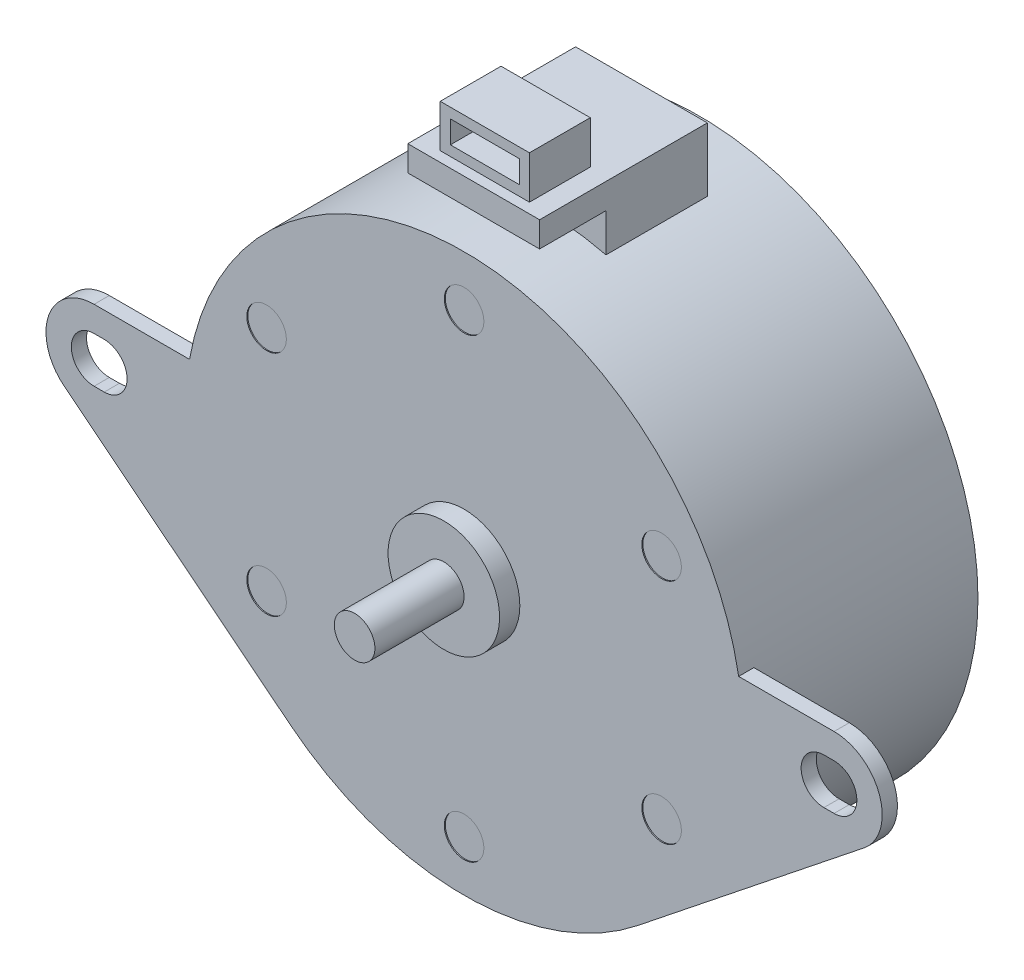
from build123d import *

# Parameters (mm, degrees)
SKETCH1_W                    = 27.5
SKETCH1_H                    = 23.2
BOSS_EXTRUDE1_REACH          = 86.991
BOSS_EXTRUDE1_END_RADIUS     = 27.5
SKETCH2_W                    = 13
SKETCH2_H                    = 10
SKETCH3_W                    = 13
SKETCH3_H                    = 2.5
BOSS_EXTRUDE2_DEPTH          = 6.553262411
BOSS_EXTRUDE3_DEPTH          = 1.5
BOSS_EXTRUDE4_DEPTH          = 1.5
CUT_EXTRUDE1_DEPTH           = 95.472495998
CUT_EXTRUDE2_DEPTH           = 95.115368033
SKETCH8_R                    = 5.5
BOSS_EXTRUDE5_DEPTH          = 2
SKETCH9_R                    = 2
BOSS_EXTRUDE6_DEPTH          = 8.8
SKETCH10_W                   = 8.8
SKETCH10_H                   = 6
BOSS_EXTRUDE7_DEPTH          = 4.22
SKETCH11_W                   = 6.8
SKETCH11_H                   = 2.22
CUT_EXTRUDE3_DEPTH           = 5
SKETCH12_R                   = 19.15
BOSS_EXTRUDE8_DEPTH          = 1.5
BOSS_EXTRUDE8_TAPER          = 45
F_7_0_7_DIAMETER_HOLE1_D     = 7
F_7_0_7_DIAMETER_HOLE1_DEPTH = 1.5
SKETCH15_W                   = 1.95
SKETCH15_H                   = 0.1
SKETCH16_W                   = 1.95
SKETCH16_H                   = 0.1
SKETCH17_W                   = 1.95
SKETCH17_H                   = 0.1
SKETCH18_W                   = 1.95
SKETCH18_H                   = 0.1
SKETCH19_W                   = 1.95
SKETCH19_H                   = 0.1
SKETCH20_W                   = 1.95
SKETCH20_H                   = 0.1
SKETCH21_W                   = 2
SKETCH21_H                   = 7
SKETCH22_W                   = 1.95
SKETCH22_H                   = 0.9
SKETCH23_W                   = 1.95
SKETCH23_H                   = 0.9
SKETCH24_W                   = 1.95
SKETCH24_H                   = 0.9
SKETCH25_W                   = 1.95
SKETCH25_H                   = 0.9
SKETCH26_W                   = 1.95
SKETCH26_H                   = 0.9
SKETCH27_W                   = 1.95
SKETCH27_H                   = 0.9


with BuildPart() as part:
    # Sketch1 → Revolve1 (revolve)
    with BuildSketch(Plane.XZ.offset(-27.5), mode=Mode.PRIVATE) as revolve1_sk:
        with Locations((41.25, 11.6)):
            Rectangle(SKETCH1_W, SKETCH1_H)
    revolve(revolve1_sk.sketch.rotate(Axis((27.5, 27.5, 23.2), (0, 0, -1)), 180), axis=Axis((27.5, 27.5, 23.2), (0, 0, -1)))

    # Boss-Extrude1: up to this cylinder (the profile starts outside it)
    boss_extrude1_end = Plane(origin=(27.5, 27.5, 10.7), z_dir=(0, 0, -1)) * Cylinder(BOSS_EXTRUDE1_END_RADIUS, 229.982, mode=Mode.PRIVATE)
    # Sketch2 → Boss-Extrude1 (add, up to the surface)
    with BuildSketch(Plane(origin=(0, 60.5, 0), x_dir=(1, 0, 0), z_dir=(0, 1, 0)), mode=Mode.PRIVATE) as boss_extrude1_sk1:
        with Locations((27.5, -10.7)):
            Rectangle(SKETCH2_W, SKETCH2_H)
    boss_extrude1_tool1 = extrude(boss_extrude1_sk1.sketch, amount=-BOSS_EXTRUDE1_REACH, mode=Mode.PRIVATE) - boss_extrude1_end
    add(boss_extrude1_tool1.solids().sort_by_distance((27.5, 60.5, 10.7))[0])

    # Sketch3 → Boss-Extrude2 (add)
    with BuildSketch(Plane.XY.offset(15.7)):
        with Locations((27.5, 59.25)):
            Rectangle(SKETCH3_W, SKETCH3_H)
    extrude(amount=BOSS_EXTRUDE2_DEPTH)

    # Sketch4 → Boss-Extrude3 (add)
    with BuildSketch(Plane.XY.offset(23.2)):
        with BuildLine():
            Line((64, 32.25), (54.586666462, 32.25))
            ThreePointArc((54.586666462, 32.25), (53.216477037, 17.757679496), (44.640410959, 5.995202578))
            Line((44.640410959, 5.995202578), (66.960616438, 23.785534991))
            ThreePointArc((66.960616438, 23.785534991), (68.483648559, 29.068246028), (64, 32.25))
        make_face()
    extrude(amount=-BOSS_EXTRUDE3_DEPTH)

    # Sketch5 → Boss-Extrude4 (add)
    with BuildSketch(Plane.XY.offset(23.2)):
        with BuildLine():
            Line((-11.960616438, 23.785534991), (10.359589041, 5.995202578))
            ThreePointArc((10.359589041, 5.995202578), (1.783522963, 17.757679496), (0.413333538, 32.25))
            Line((0.413333538, 32.25), (-9, 32.25))
            ThreePointArc((-9, 32.25), (-13.483648559, 29.068246028), (-11.960616438, 23.785534991))
        make_face()
    extrude(amount=-BOSS_EXTRUDE4_DEPTH)

    # Sketch6 → Cut-Extrude1 (cut, through all)
    with BuildSketch(Plane.XY.offset(23.2)):
        with BuildLine():
            Line((63, 25.25), (64, 25.25))
            ThreePointArc((64, 25.25), (66.25, 27.5), (64, 29.75))
            Line((64, 29.75), (63, 29.75))
            ThreePointArc((63, 29.75), (60.75, 27.5), (63, 25.25))
        make_face()
    extrude(amount=-CUT_EXTRUDE1_DEPTH, mode=Mode.SUBTRACT)

    # Sketch7 → Cut-Extrude2 (cut, through all)
    with BuildSketch(Plane(origin=(0, 0, 21.7), x_dir=(-1, 0, 0), z_dir=(0, 0, -1))):
        with BuildLine():
            Line((8, 25.25), (9, 25.25))
            ThreePointArc((9, 25.25), (11.25, 27.5), (9, 29.75))
            Line((9, 29.75), (8, 29.75))
            ThreePointArc((8, 29.75), (5.75, 27.5), (8, 25.25))
        make_face()
    extrude(amount=-CUT_EXTRUDE2_DEPTH, mode=Mode.SUBTRACT)

    # Sketch8 → Boss-Extrude5 (add)
    with BuildSketch(Plane.XY.offset(23.2)):
        with Locations((27.5, 27.5)):
            Circle(SKETCH8_R)
    extrude(amount=BOSS_EXTRUDE5_DEPTH)

    # Sketch9 → Boss-Extrude6 (add)
    with BuildSketch(Plane.XY.offset(25.2)):
        with Locations((27.5, 27.5)):
            Circle(SKETCH9_R)
    extrude(amount=BOSS_EXTRUDE6_DEPTH)

    # Sketch10 → Boss-Extrude7 (add)
    with BuildSketch(Plane(origin=(0, 60.5, 0), x_dir=(-1, 0, 0), z_dir=(0, 1, 0))):
        with Locations((-27.6, 18.253262411)):
            Rectangle(SKETCH10_W, SKETCH10_H)
    extrude(amount=BOSS_EXTRUDE7_DEPTH)

    # Sketch11 → Cut-Extrude3 (cut)
    with BuildSketch(Plane.XY.offset(21.253262411)):
        with Locations((27.6, 62.61)):
            Rectangle(SKETCH11_W, SKETCH11_H)
    extrude(amount=-CUT_EXTRUDE3_DEPTH, mode=Mode.SUBTRACT)

    # Sketch12 → Boss-Extrude8 (add)
    with BuildSketch(Plane(origin=(0, 0, 0), x_dir=(-1, 0, 0), z_dir=(0, 0, -1))):
        with Locations((-27.5, 27.5)):
            Circle(SKETCH12_R)
    extrude(amount=BOSS_EXTRUDE8_DEPTH, taper=BOSS_EXTRUDE8_TAPER)

    # Ø7.0 (7) Diameter Hole1
    with Locations(Plane(origin=(0, 0, -1.5), x_dir=(-1, 0, 0), z_dir=(0, 0, -1))):
        with Locations((-27.5, 27.5)):
            Hole(F_7_0_7_DIAMETER_HOLE1_D / 2, depth=F_7_0_7_DIAMETER_HOLE1_DEPTH)

    # Sketch15 → Cut-Revolve1 (revolve, cut)
    with BuildSketch(Plane(origin=(0, 16.25, 0), x_dir=(1, 0, 0), z_dir=(0, 1, 0))):
        with Locations((8.989428415, -23.15)):
            Rectangle(SKETCH15_W, SKETCH15_H)
    revolve(axis=Axis((8.014428415, 16.25, 23.1), (0, 0, 1)), mode=Mode.SUBTRACT)

    # Sketch16 → Cut-Revolve2 (revolve, cut)
    with BuildSketch(Plane(origin=(0, 5, 0), x_dir=(1, 0, 0), z_dir=(0, 1, 0))):
        with Locations((28.475, -23.15)):
            Rectangle(SKETCH16_W, SKETCH16_H)
    revolve(axis=Axis((27.5, 5, 23.1), (0, 0, 1)), mode=Mode.SUBTRACT)

    # Sketch17 → Cut-Revolve3 (revolve, cut)
    with BuildSketch(Plane(origin=(0, 16.25, 0), x_dir=(1, 0, 0), z_dir=(0, 1, 0))):
        with Locations((47.960571585, -23.15)):
            Rectangle(SKETCH17_W, SKETCH17_H)
    revolve(axis=Axis((46.985571585, 16.25, 23.1), (0, 0, 1)), mode=Mode.SUBTRACT)

    # Sketch18 → Cut-Revolve4 (revolve, cut)
    with BuildSketch(Plane(origin=(0, 38.75, 0), x_dir=(1, 0, 0), z_dir=(0, 1, 0))):
        with Locations((47.960571585, -23.15)):
            Rectangle(SKETCH18_W, SKETCH18_H)
    revolve(axis=Axis((46.985571585, 38.75, 23.1), (0, 0, 1)), mode=Mode.SUBTRACT)

    # Sketch19 → Cut-Revolve5 (revolve, cut)
    with BuildSketch(Plane(origin=(0, 50, 0), x_dir=(1, 0, 0), z_dir=(0, 1, 0))):
        with Locations((28.475, -23.15)):
            Rectangle(SKETCH19_W, SKETCH19_H)
    revolve(axis=Axis((27.5, 50, 23.1), (0, 0, 1)), mode=Mode.SUBTRACT)

    # Sketch20 → Cut-Revolve6 (revolve, cut)
    with BuildSketch(Plane(origin=(0, 38.75, 0), x_dir=(1, 0, 0), z_dir=(0, 1, 0))):
        with Locations((8.989428415, -23.15)):
            Rectangle(SKETCH20_W, SKETCH20_H)
    revolve(axis=Axis((8.014428415, 38.75, 23.1), (0, 0, 1)), mode=Mode.SUBTRACT)

    # Sketch21 → Revolve2 (revolve)
    with BuildSketch(Plane(origin=(0, 27.5, 0), x_dir=(1, 0, 0), z_dir=(0, 1, 0)), mode=Mode.PRIVATE) as revolve2_sk:
        with Locations((28.5, 3.5)):
            Rectangle(SKETCH21_W, SKETCH21_H)
    revolve(revolve2_sk.sketch.rotate(Axis((27.5, 27.5, -7), (0, 0, 1)), 180), axis=Axis((27.5, 27.5, -7), (0, 0, 1)))

    # Sketch22 → Revolve3 (revolve)
    with BuildSketch(Plane(origin=(0, 16.25, 0), x_dir=(1, 0, 0), z_dir=(0, 1, 0))):
        with Locations((47.960571585, 0.45)):
            Rectangle(SKETCH22_W, SKETCH22_H)
    revolve(axis=Axis((46.985571585, 16.25, -0.9), (0, 0, 1)))

    # Sketch23 → Revolve4 (revolve)
    with BuildSketch(Plane(origin=(0, 5, 0), x_dir=(1, 0, 0), z_dir=(0, 1, 0))):
        with Locations((28.475, 0.45)):
            Rectangle(SKETCH23_W, SKETCH23_H)
    revolve(axis=Axis((27.5, 5, -0.9), (0, 0, 1)))

    # Sketch24 → Revolve5 (revolve)
    with BuildSketch(Plane(origin=(0, 16.25, 0), x_dir=(1, 0, 0), z_dir=(0, 1, 0))):
        with Locations((8.989428415, 0.45)):
            Rectangle(SKETCH24_W, SKETCH24_H)
    revolve(axis=Axis((8.014428415, 16.25, -0.9), (0, 0, 1)))

    # Sketch25 → Revolve6 (revolve)
    with BuildSketch(Plane(origin=(0, 38.75, 0), x_dir=(1, 0, 0), z_dir=(0, 1, 0))):
        with Locations((8.989428415, 0.45)):
            Rectangle(SKETCH25_W, SKETCH25_H)
    revolve(axis=Axis((8.014428415, 38.75, -0.9), (0, 0, 1)))

    # Sketch26 → Revolve7 (revolve)
    with BuildSketch(Plane(origin=(0, 50, 0), x_dir=(1, 0, 0), z_dir=(0, 1, 0))):
        with Locations((28.475, 0.45)):
            Rectangle(SKETCH26_W, SKETCH26_H)
    revolve(axis=Axis((27.5, 50, -0.9), (0, 0, 1)))

    # Sketch27 → Revolve8 (revolve)
    with BuildSketch(Plane(origin=(0, 38.75, 0), x_dir=(1, 0, 0), z_dir=(0, 1, 0))):
        with Locations((47.960571585, 0.45)):
            Rectangle(SKETCH27_W, SKETCH27_H)
    revolve(axis=Axis((46.985571585, 38.75, -0.9), (0, 0, 1)))


solid = part.part
